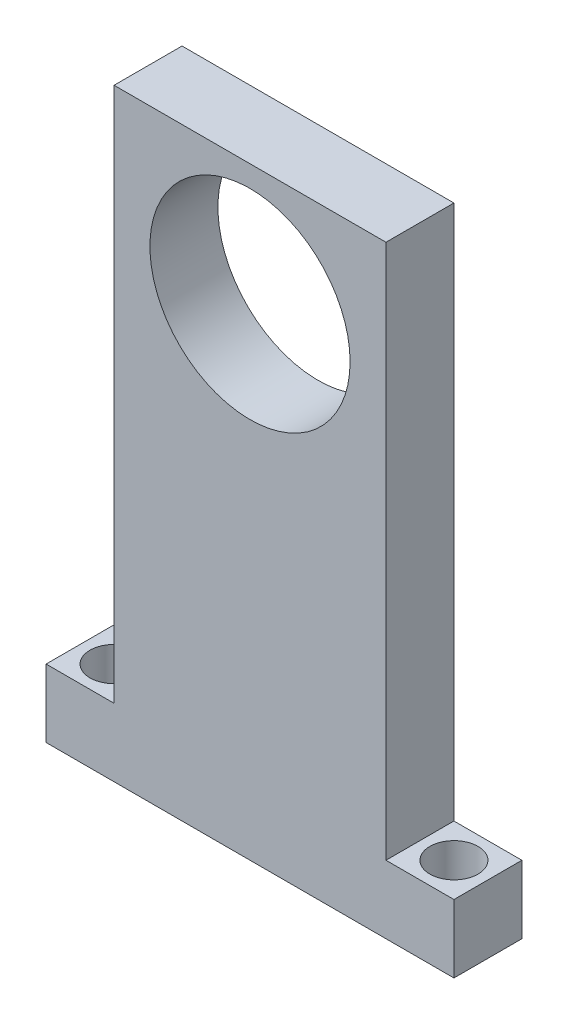
from build123d import *

# Parameters (mm, degrees)
SKETCH1_W           = 38.1
SKETCH1_H           = 6.35
BOSS_EXTRUDE1_DEPTH = 6.35
SKETCH3_W           = 25.4
SKETCH3_H           = 6.35
BOSS_EXTRUDE2_DEPTH = 50
SKETCH6_R           = 9.35
CUT_EXTRUDE3_DEPTH  = 60.820962045
SKETCH4_R           = 2.2479
CUT_EXTRUDE1_DEPTH  = 54.600215718
SKETCH5_R           = 9.017
CUT_EXTRUDE2_DEPTH  = 60.820962045


with BuildPart() as part:
    # Sketch1 → Boss-Extrude1 (new body)
    with BuildSketch(Plane(origin=(0, 0, 0), x_dir=(1, 0, 0), z_dir=(0, 1, 0))):
        Rectangle(SKETCH1_W, SKETCH1_H)
    extrude(amount=BOSS_EXTRUDE1_DEPTH)

    # Sketch3 → Boss-Extrude2 (add)
    with BuildSketch(Plane(origin=(0, 6.35, 0), x_dir=(1, 0, 0), z_dir=(0, 1, 0))):
        Rectangle(SKETCH3_W, SKETCH3_H)
    extrude(amount=BOSS_EXTRUDE2_DEPTH)

    # Sketch6 → Cut-Extrude3 (cut, through all)
    with BuildSketch(Plane.XY.offset(3.175)):
        with Locations((0, 45)):
            Circle(SKETCH6_R)
    extrude(amount=-CUT_EXTRUDE3_DEPTH, mode=Mode.SUBTRACT)

    # Sketch4 → Cut-Extrude1 (cut, through all)
    with BuildSketch(Plane(origin=(0, 6.35, 0), x_dir=(1, 0, 0), z_dir=(0, 1, 0))):
        with Locations(Location((-15.875, 0, 0), (0, 0, 270))):
            Circle(SKETCH4_R)
        with Locations(Location((15.875, 0, 0), (0, 0, 270))):
            Circle(SKETCH4_R)
    extrude(amount=-CUT_EXTRUDE1_DEPTH, mode=Mode.SUBTRACT)

    # Sketch5 → Cut-Extrude2 (cut, through all)
    with BuildSketch(Plane.XY.offset(3.175)):
        with Locations((0, 45.25679453)):
            Circle(SKETCH5_R)
    extrude(amount=-CUT_EXTRUDE2_DEPTH, mode=Mode.SUBTRACT)


solid = part.part
